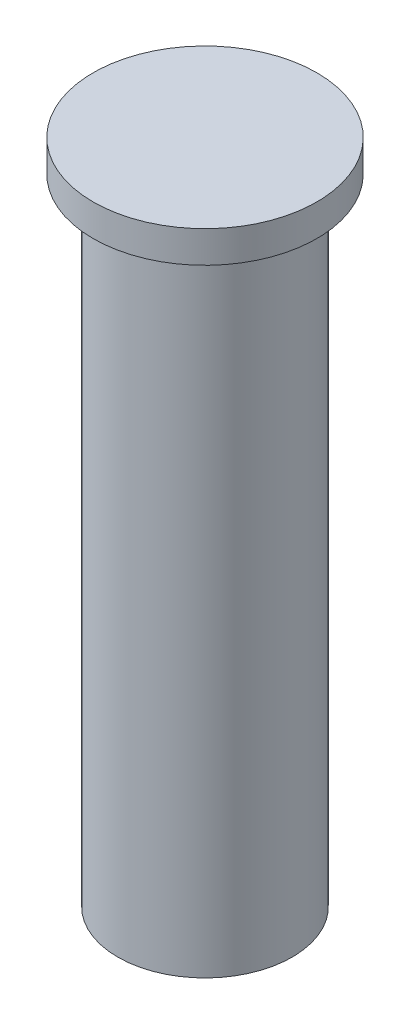
from build123d import *

# Parameters (mm, degrees)
SKETCH2_R           = 6.985
BOSS_EXTRUDE1_DEPTH = 50.8
SKETCH3_R           = 8.956914726
BOSS_EXTRUDE2_DEPTH = 2.54


with BuildPart() as part:
    # Sketch2 → Boss-Extrude1 (new body)
    with BuildSketch(Plane(origin=(0, 0, 0), x_dir=(1, 0, 0), z_dir=(0, 1, 0))):
        with Locations(Location((0, 0, 0), (0, 0, 270))):
            Circle(SKETCH2_R)
    extrude(amount=BOSS_EXTRUDE1_DEPTH)

    # Sketch3 → Boss-Extrude2 (add)
    with BuildSketch(Plane(origin=(0, 50.8, 0), x_dir=(1, 0, 0), z_dir=(0, 1, 0))):
        with Locations(Location((0, 0, 0), (0, 0, 270))):
            Circle(SKETCH3_R)
    extrude(amount=BOSS_EXTRUDE2_DEPTH)


solid = part.part
